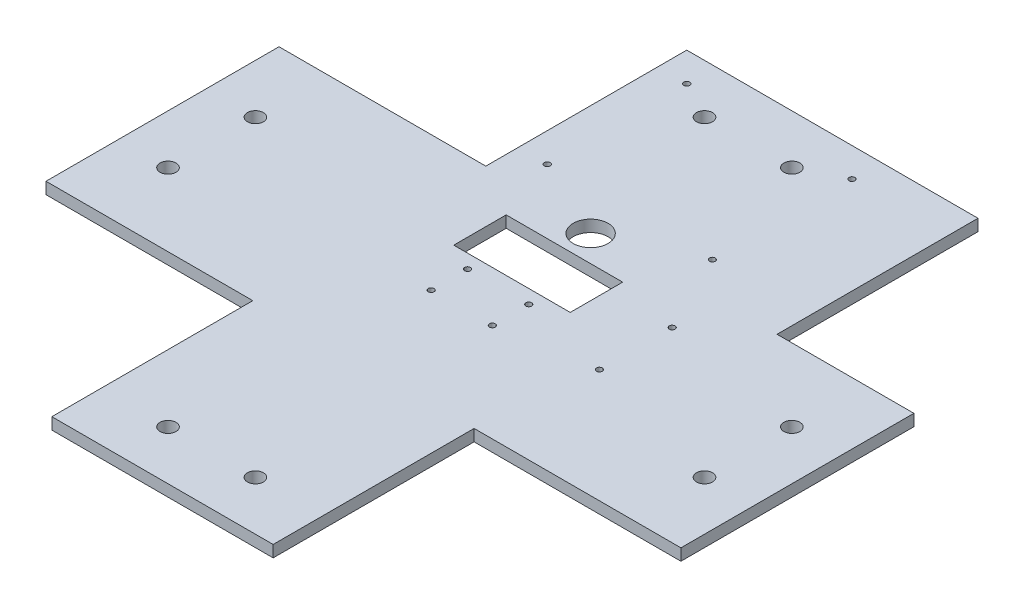
from build123d import *

# Parameters (mm, degrees)
SKETCH1_W           = 100
SKETCH1_H           = 80
BOSS_EXTRUDE1_DEPTH = 4
SKETCH2_R           = 1
CUT_EXTRUDE1_DEPTH  = 65.156059729
BOSS_EXTRUDE2_DEPTH = 4
SKETCH4_R           = 1
CUT_EXTRUDE2_DEPTH  = 4
SKETCH5_R           = 1
CUT_EXTRUDE3_DEPTH  = 4
SKETCH6_R           = 6
CUT_EXTRUDE4_DEPTH  = 95.424573073
BOSS_EXTRUDE3_DEPTH = 4
SKETCH8_R           = 2.75
CUT_EXTRUDE5_DEPTH  = 216.273272068


with BuildPart() as part:
    # Sketch1 → Boss-Extrude1 (new body)
    with BuildSketch(Plane(origin=(0, 0, 0), x_dir=(1, 0, 0), z_dir=(0, 1, 0))):
        Rectangle(SKETCH1_W, SKETCH1_H)
    extrude(amount=BOSS_EXTRUDE1_DEPTH)

    # Sketch2 → Cut-Extrude1 (cut, through all)
    with BuildSketch(Plane(origin=(0, 4, 0), x_dir=(1, 0, 0), z_dir=(0, 1, 0))):
        with Locations(Location((-40, 30, 0), (0, 0, 270))):
            Circle(SKETCH2_R)
        with Locations(Location((16.7, 30, 0), (0, 0, 270))):
            Circle(SKETCH2_R)
        with Locations(Location((16.7, -17.9, 0), (0, 0, 270))):
            Circle(SKETCH2_R)
        with Locations(Location((-40, -17.9, 0), (0, 0, 270))):
            Circle(SKETCH2_R)
    extrude(amount=-CUT_EXTRUDE1_DEPTH, mode=Mode.SUBTRACT)

    # Sketch3 → Boss-Extrude2 (add)
    with BuildSketch(Plane(origin=(0, 4, 0), x_dir=(1, 0, 0), z_dir=(0, 1, 0))):
        Polygon((7.993464363, -40), (50, -40), (50, -80), (-50, -80), (-50, -40), (-32.006535637, -40), (-32.006535637, -58), (7.993464363, -58), align=None)
    extrude(amount=-BOSS_EXTRUDE2_DEPTH)

    # Sketch4 → Cut-Extrude2 (cut)
    with BuildSketch(Plane(origin=(0, 4, 0), x_dir=(1, 0, 0), z_dir=(0, 1, 0))):
        with Locations(Location((-22.506535637, -62.75, 0), (0, 0, 270))):
            Circle(SKETCH4_R)
        with Locations(Location((-22.506535637, -75.25, 0), (0, 0, 270))):
            Circle(SKETCH4_R)
        with Locations(Location((-1.506535637, -75.25, 0), (0, 0, 270))):
            Circle(SKETCH4_R)
        with Locations(Location((-1.506535637, -62.75, 0), (0, 0, 270))):
            Circle(SKETCH4_R)
    extrude(amount=-CUT_EXTRUDE2_DEPTH, mode=Mode.SUBTRACT)

    # Sketch5 → Cut-Extrude3 (cut)
    with BuildSketch(Plane(origin=(0, 4, 0), x_dir=(1, 0, 0), z_dir=(0, 1, 0))):
        with Locations(Location((30, -45, 0), (0, 0, 270))):
            Circle(SKETCH5_R)
        with Locations(Location((30, -70, 0), (0, 0, 270))):
            Circle(SKETCH5_R)
    extrude(amount=-CUT_EXTRUDE3_DEPTH, mode=Mode.SUBTRACT)

    # Sketch6 → Cut-Extrude4 (cut, through all)
    with BuildSketch(Plane(origin=(0, 4, 0), x_dir=(1, 0, 0), z_dir=(0, 1, 0))):
        with Locations(Location((-12.006535637, -31, 0), (0, 0, 270))):
            Circle(SKETCH6_R)
    extrude(amount=-CUT_EXTRUDE4_DEPTH, mode=Mode.SUBTRACT)

    # Sketch7 → Boss-Extrude3 (add)
    with BuildSketch(Plane.XZ):
        Polygon((96.993464363, 29), (50, 29), (50, 80), (-50, 80), (-50, 29), (-121.006535637, 29), (-121.006535637, 109), (-50, 109), (-50, 178), (25.986928727, 178), (25.986928727, 109), (96.993464363, 109), align=None)
    extrude(amount=-BOSS_EXTRUDE3_DEPTH)

    # Sketch8 → Cut-Extrude5 (cut, through all)
    with BuildSketch(Plane(origin=(0, 4, 0), x_dir=(1, 0, 0), z_dir=(0, 1, 0))):
        with Locations(Location((-104.106535637, -84, 0), (0, 0, 270))):
            Circle(SKETCH8_R)
        with Locations(Location((-104.106535637, -54, 0), (0, 0, 90))):
            Circle(SKETCH8_R)
        with Locations(Location((80.093464363, -54, 0), (0, 0, 270))):
            Circle(SKETCH8_R)
        with Locations(Location((80.093464363, -84, 0), (0, 0, 90))):
            Circle(SKETCH8_R)
        with Locations(Location((-27.006535637, 23.1, 0), (0, 0, 270))):
            Circle(SKETCH8_R)
        with Locations(Location((2.993464363, 23.1, 0), (0, 0, 90))):
            Circle(SKETCH8_R)
        with Locations(Location((2.993464363, -161.1, 0), (0, 0, 270))):
            Circle(SKETCH8_R)
        with Locations(Location((-27.006535637, -161.1, 0), (0, 0, 90))):
            Circle(SKETCH8_R)
    extrude(amount=-CUT_EXTRUDE5_DEPTH, mode=Mode.SUBTRACT)


solid = part.part
